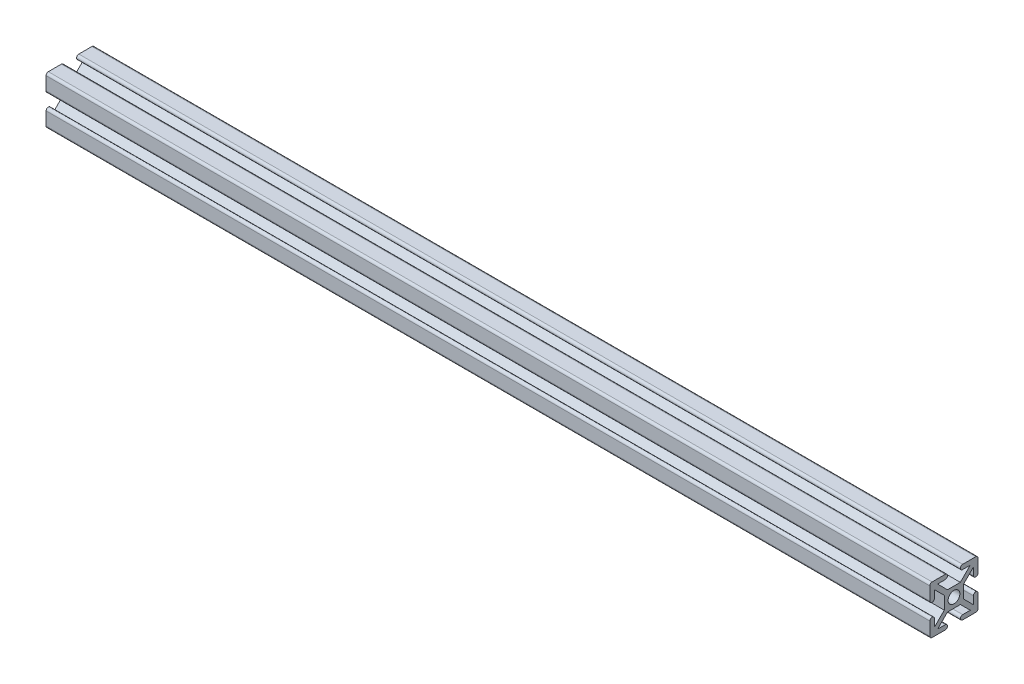
from build123d import *

# Parameters (mm, degrees)
SKETCH1_R           = 3.645
BOSS_EXTRUDE1_DEPTH = 550


with BuildPart() as part:
    # Sketch1 → Boss-Extrude1 (new body)
    with BuildSketch(Plane(origin=(0, 0, 0), x_dir=(0, 0, -1), z_dir=(1, 0, 0))):
        with BuildLine():
            Line((52.123693748, 30.874275451), (56.848693748, 30.874275451))
            Line((56.848693748, 30.874275451), (50.698693748, 37.024275451))
            Line((50.698693748, 37.024275451), (42.698693748, 37.024275451))
            Line((42.698693748, 37.024275451), (36.548693748, 30.874275451))
            Line((36.548693748, 30.874275451), (41.273693748, 30.874275451))
            ThreePointArc((41.273693748, 30.874275451), (42.698693748, 29.449275451), (41.273693748, 28.024275451))
            Line((41.273693748, 28.024275451), (33.097257975, 28.050711224))
            ThreePointArc((33.097257975, 28.050711224), (32.108323726, 28.460341202), (31.698693748, 29.449275451))
            Line((31.698693748, 29.449275451), (31.698693748, 37.599275451))
            ThreePointArc((31.698693748, 37.599275451), (33.097257975, 38.997839678), (34.495822203, 37.599275451))
            Line((34.495822203, 37.599275451), (34.495822203, 32.874275451))
            Line((34.495822203, 32.874275451), (40.645822203, 39.024275451))
            Line((40.645822203, 39.024275451), (40.645822203, 47.024275451))
            Line((40.645822203, 47.024275451), (34.495822203, 53.174275451))
            Line((34.495822203, 53.174275451), (34.495822203, 48.449275451))
            ThreePointArc((34.495822203, 48.449275451), (33.070822203, 47.024275451), (31.645822203, 48.449275451))
            Line((31.645822203, 48.449275451), (31.645822203, 56.599228861))
            ThreePointArc((31.645822203, 56.599228861), (32.06319504, 57.606856024), (33.070822203, 58.024228861))
            Line((33.070822203, 58.024228861), (41.220822203, 58.024228861))
            ThreePointArc((41.220822203, 58.024228861), (42.645822203, 56.599228861), (41.220822203, 55.174228861))
            Line((41.220822203, 55.174228861), (36.495822203, 55.174228861))
            Line((36.495822203, 55.174228861), (42.645822203, 49.024228861))
            Line((42.645822203, 49.024228861), (50.645822203, 49.024228861))
            Line((50.645822203, 49.024228861), (56.795822203, 55.174228861))
            Line((56.795822203, 55.174228861), (52.070822203, 55.174228861))
            ThreePointArc((52.070822203, 55.174228861), (50.645822203, 56.599228861), (52.070822203, 58.024228861))
            Line((52.070822203, 58.024228861), (60.220822203, 58.024228861))
            ThreePointArc((60.220822203, 58.024228861), (61.228449366, 57.606856024), (61.645822203, 56.599228861))
            Line((61.645822203, 56.599228861), (61.645822203, 48.552972547))
            ThreePointArc((61.645822203, 48.552972547), (60.220822203, 47.127972547), (58.795822203, 48.552972547))
            Line((58.795822203, 48.552972547), (58.795822203, 53.174228861))
            Line((58.795822203, 53.174228861), (52.645822203, 47.024228861))
            Line((52.645822203, 47.024228861), (52.645822203, 39.024228861))
            Line((52.645822203, 39.024228861), (58.795822203, 32.874228861))
            Line((58.795822203, 32.874228861), (58.795822203, 37.702972547))
            ThreePointArc((58.795822203, 37.702972547), (60.220822203, 39.127972547), (61.645822203, 37.702972547))
            Line((61.645822203, 37.702972547), (61.645822203, 29.449275451))
            ThreePointArc((61.645822203, 29.449275451), (61.228449366, 28.441648288), (60.220822203, 28.024275451))
            Line((60.220822203, 28.024275451), (52.123693748, 28.024275451))
            ThreePointArc((52.123693748, 28.024275451), (50.698693748, 29.449275451), (52.123693748, 30.874275451))
        make_face()
        with Locations((46.698693748, 43.024275451)):
            Circle(SKETCH1_R, mode=Mode.SUBTRACT)
    extrude(amount=BOSS_EXTRUDE1_DEPTH)


solid = part.part
